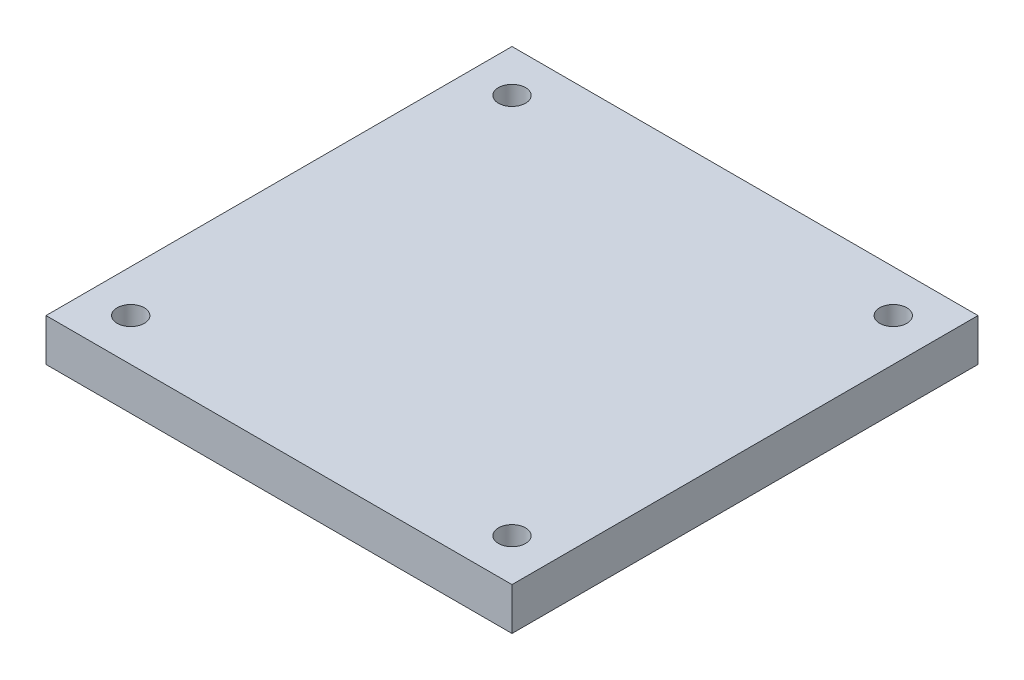
from build123d import *

# Parameters (mm, degrees)
SKETCH1_W           = 55
SKETCH1_H           = 55
BOSS_EXTRUDE1_DEPTH = 5
SKETCH2_R           = 1.6
CUT_EXTRUDE1_DEPTH  = 5


with BuildPart() as part:
    # Sketch1 → Boss-Extrude1 (new body)
    with BuildSketch(Plane(origin=(0, 0, 0), x_dir=(1, 0, 0), z_dir=(0, 1, 0))):
        Rectangle(SKETCH1_W, SKETCH1_H)
    extrude(amount=BOSS_EXTRUDE1_DEPTH)

    # Sketch2 → Cut-Extrude1 (cut)
    with BuildSketch(Plane.XZ):
        with Locations(Location((-22.5, 22.5, 0), (0, 0, 270))):
            Circle(SKETCH2_R)
        with Locations(Location((22.5, 22.5, 0), (0, 0, 270))):
            Circle(SKETCH2_R)
        with Locations(Location((22.5, -22.5, 0), (0, 0, 270))):
            Circle(SKETCH2_R)
        with Locations(Location((-22.5, -22.5, 0), (0, 0, 270))):
            Circle(SKETCH2_R)
    extrude(amount=-CUT_EXTRUDE1_DEPTH, mode=Mode.SUBTRACT)


solid = part.part
